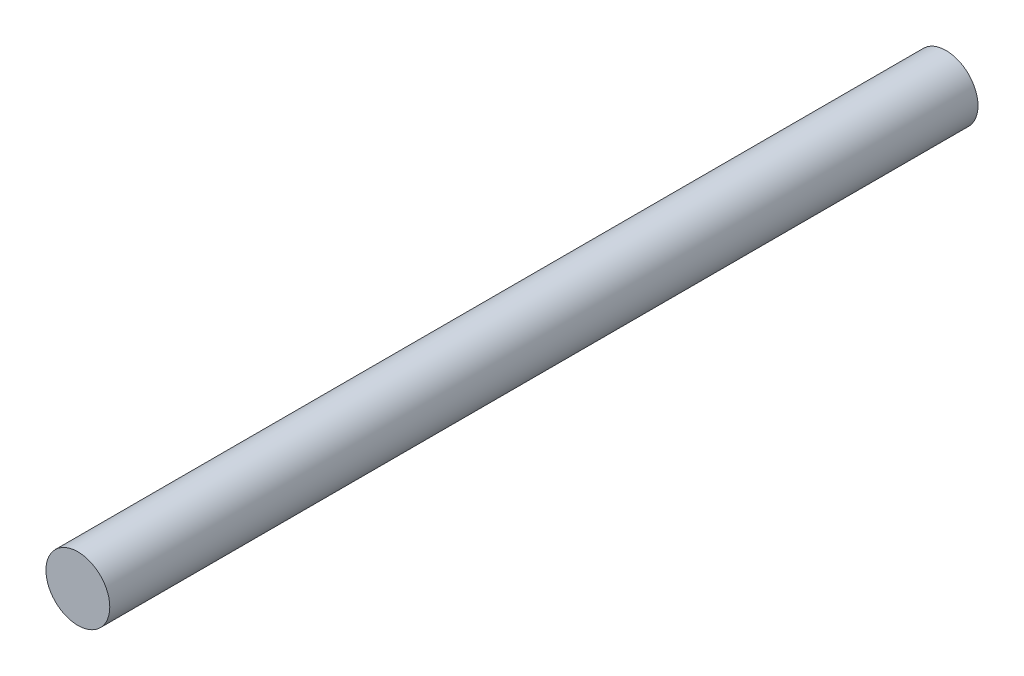
from build123d import *

# Parameters (mm, degrees)
SKETCH1_R  = 1.5875
BODY_DEPTH = 43.18


with BuildPart() as part:
    # Sketch1 → Body (new body)
    with BuildSketch(Plane.XY):
        Circle(SKETCH1_R)
    extrude(amount=-BODY_DEPTH)


solid = part.part
